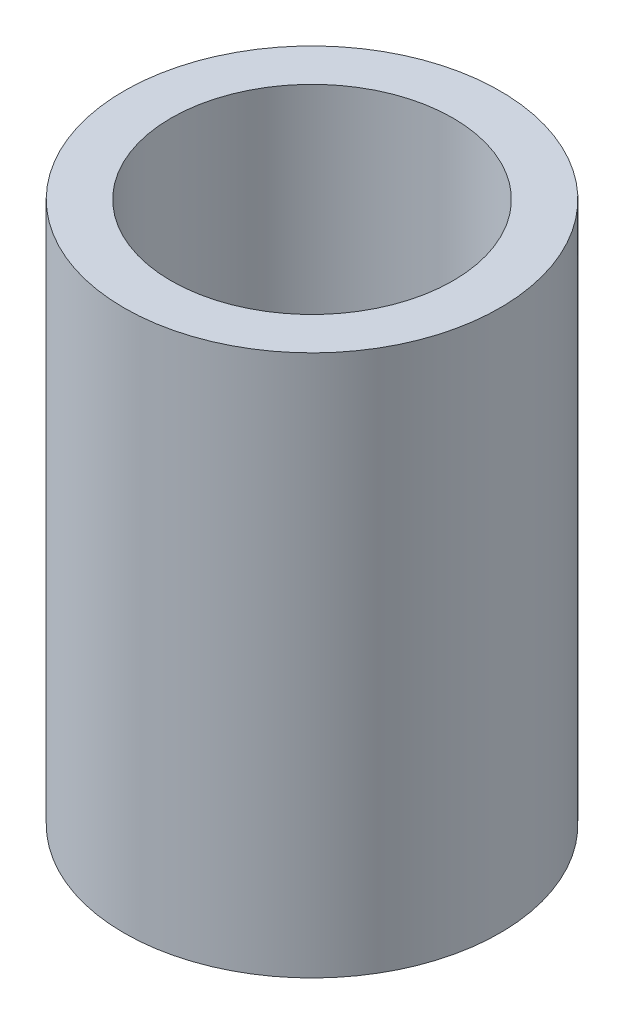
from build123d import *

# Parameters (mm, degrees)
SKETCH1_R           = 10
SKETCH1_R_2         = 7.5
BOSS_EXTRUDE1_DEPTH = 28.8


with BuildPart() as part:
    # Sketch1 → Boss-Extrude1 (new body)
    with BuildSketch(Plane(origin=(0, 0, 0), x_dir=(1, 0, 0), z_dir=(0, 1, 0))):
        with Locations(Location((0, 0, 0), (0, 0, 270))):
            Circle(SKETCH1_R)
        with Locations(Location((0, 0, 0), (0, 0, 270))):
            Circle(SKETCH1_R_2, mode=Mode.SUBTRACT)
    extrude(amount=BOSS_EXTRUDE1_DEPTH)


solid = part.part
